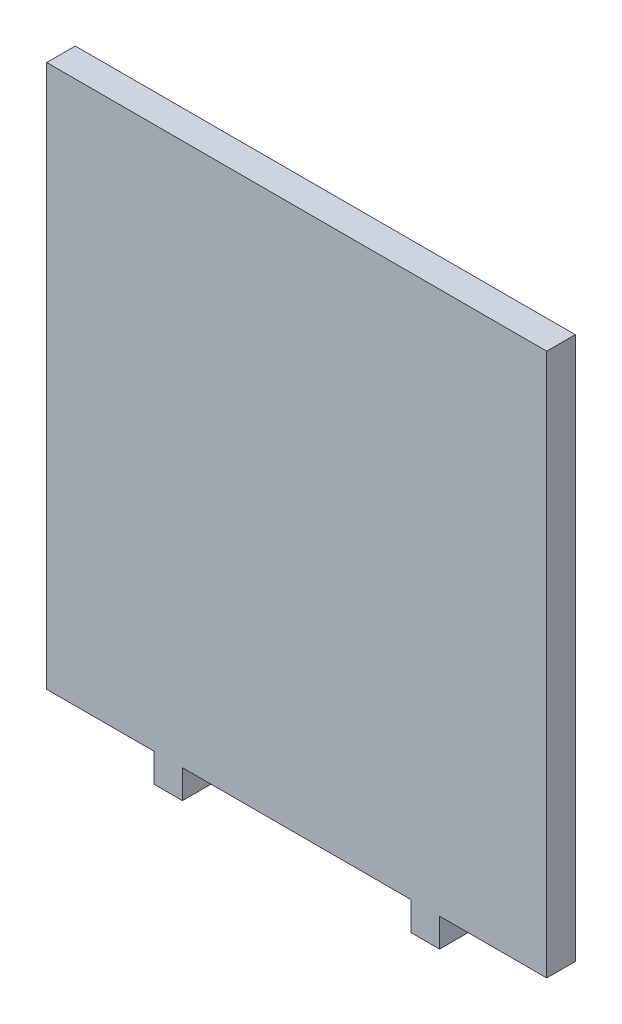
from build123d import *

# Parameters (mm, degrees)
BOSS_EXTRU_1_DEPTH = 4


with BuildPart() as part:
    # Esquisse1 → Boss.-Extru.1 (new body)
    with BuildSketch(Plane.XY):
        Polygon((16, -38), (-16, -38), (-16, -42), (-20, -42), (-20, -38), (-35, -38), (-35, 38), (35, 38), (35, -38), (20, -38), (20, -42), (16, -42), align=None)
    extrude(amount=BOSS_EXTRU_1_DEPTH)


solid = part.part
